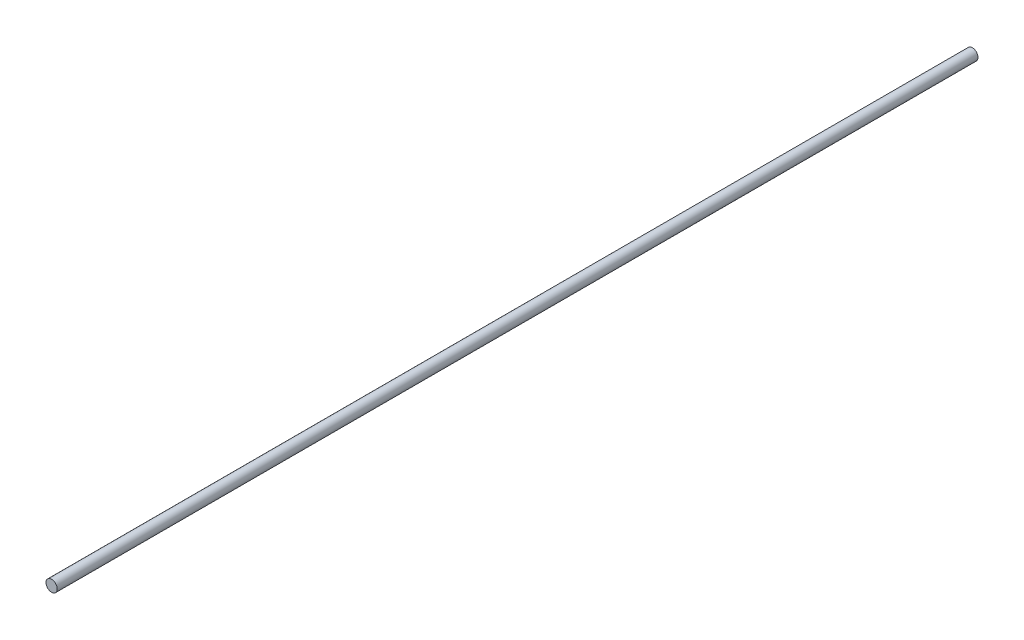
from build123d import *

# Parameters (mm, degrees)
SKETCH1_R           = 4
BOSS_EXTRUDE1_DEPTH = 655


with BuildPart() as part:
    # Sketch1 → Boss-Extrude1 (new body)
    with BuildSketch(Plane.XY):
        Circle(SKETCH1_R)
    extrude(amount=-BOSS_EXTRUDE1_DEPTH)


solid = part.part
